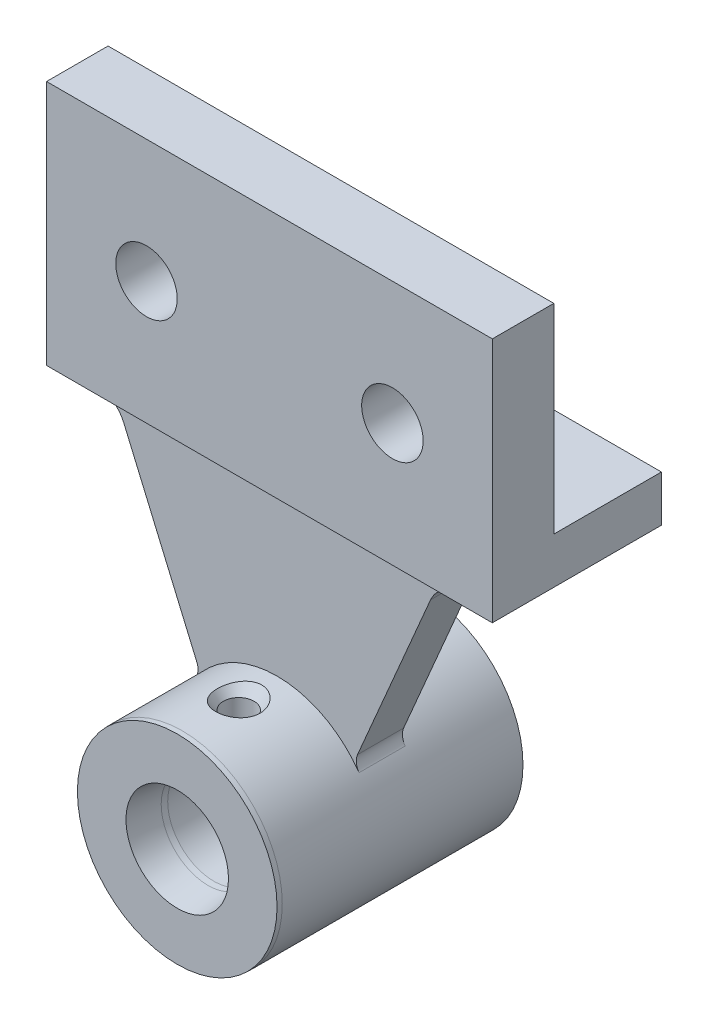
from build123d import *
from OCP.BRepFilletAPI import BRepFilletAPI_MakeChamfer

# Parameters (mm, degrees)
SKETCH_1_W               = 87
SKETCH_1_H               = 48
EXTRUDE_1_DEPTH          = 12
SKETCH_3_W               = 75
SKETCH_3_H               = 30
CUT_EXTRUDE_1_DEPTH      = 3
SKETCH_4_R               = 6
CUT_EXTRUDE_2_DEPTH      = 52.110175112
SKETCH_5_W               = 87
SKETCH_5_H               = 9
EXTRUDE_2_DEPTH          = 21
SKETCH_7_R               = 19.5
EXTRUDE_3_DEPTH          = 24
SKETCH_8_R               = 9
CUT_EXTRUDE_3_DEPTH      = 17
EXTRUDE_4_DEPTH          = 4.5
CUT_EXTRUDE_4_REACH      = 98.444
CUT_EXTRUDE_4_END_RADIUS = 9
SKETCH_13_R              = 3
CHAMFER_6_SIZE           = 1
CHAMFER_6_SIZE2          = 0.14060595
CHAMFER_6_SIZE2_2        = 0.017455065


with BuildPart() as part:
    # 草图1 → 凸台-拉伸1 (new body)
    with BuildSketch(Plane.XY):
        Rectangle(SKETCH_1_W, SKETCH_1_H)
    extrude(amount=-EXTRUDE_1_DEPTH)

    # 草图3 → 切除-拉伸1 (cut)
    with BuildSketch(Plane(origin=(0, 0, -12), x_dir=(-1, 0, 0), z_dir=(0, 0, -1))):
        Rectangle(SKETCH_3_W, SKETCH_3_H)
    extrude(amount=-CUT_EXTRUDE_1_DEPTH, mode=Mode.SUBTRACT)

    # 草图4 → 切除-拉伸2 (cut, through all)
    with BuildSketch(Plane.XY):
        with Locations((24, 0)):
            Circle(SKETCH_4_R)
        with Locations((-24, 0)):
            Circle(SKETCH_4_R)
    extrude(amount=-CUT_EXTRUDE_2_DEPTH, mode=Mode.SUBTRACT)

    # 草图5 → 凸台-拉伸2 (add)
    with BuildSketch(Plane(origin=(0, 0, -12), x_dir=(-1, 0, 0), z_dir=(0, 0, -1))):
        with Locations((0, -19.5)):
            Rectangle(SKETCH_5_W, SKETCH_5_H)
    extrude(amount=EXTRUDE_2_DEPTH)



with BuildPart() as body_2:
    # 草图7 → 凸台-拉伸3 (new, symmetric)
    with BuildSketch(Plane.XY.offset(-6)):
        with Locations((0, -75)):
            Circle(SKETCH_7_R)
    extrude(amount=EXTRUDE_3_DEPTH, both=True)

    # 草图8 → 切除-拉伸3 (cut, symmetric)
    with BuildSketch(Plane.XY.offset(-6)):
        with Locations((0, -75)):
            Circle(SKETCH_8_R)
    extrude(amount=CUT_EXTRUDE_3_DEPTH, both=True, mode=Mode.SUBTRACT)

    # 草图10 → 切除-旋转1 (revolve, cut)
    with BuildSketch(Plane(origin=(0, -75, 0), x_dir=(1, 0, 0), z_dir=(0, 1, 0))):
        Polygon((0, -18), (0, -11), (9, -11), (10, -18), align=None)
    cut_revolve_1 = revolve(axis=Axis((0, -75, 18), (0, 0, -1)), mode=Mode.SUBTRACT)

    # 镜向1: 切除-旋转1 across plane
    add(cut_revolve_1.mirror(Plane.XY.offset(-6)), mode=Mode.SUBTRACT)


with BuildPart() as part_1:
    add(part.part)

    add(body_2.part)  # 凸台-拉伸4 merges body 2
    # 草图12 → 凸台-拉伸4 (add, symmetric)
    with BuildSketch(Plane.XY.offset(-6)):
        with BuildLine():
            Line((-29.942238006, -27.63856044), (-15.687432014, -60.934386997))
            ThreePointArc((-15.687432014, -60.934386997), (-15.461093284, -62.422417649), (-15.985936875, -63.83309254))
            ThreePointArc((-15.985936875, -63.83309254), (0, -55.5), (15.985936875, -63.83309254))
            ThreePointArc((15.985936875, -63.83309254), (15.461093284, -62.422417649), (15.687432014, -60.934386997))
            Line((15.687432014, -60.934386997), (29.942238006, -27.63856044))
            ThreePointArc((29.942238006, -27.63856044), (32.154108719, -24.99157523), (35.457997537, -24))
            Line((35.457997537, -24), (-35.457997537, -24))
            ThreePointArc((-35.457997537, -24), (-32.154108719, -24.99157523), (-29.942238006, -27.63856044))
        make_face()
    extrude(amount=EXTRUDE_4_DEPTH, both=True)

    # 切除-拉伸4: up to this cylinder (the profile starts outside it)
    cut_extrude_4_end = Plane(origin=(0, -75, 6), z_dir=(0, 0, 1)) * Cylinder(CUT_EXTRUDE_4_END_RADIUS, 215.888, mode=Mode.PRIVATE)
    # 草图13 → 切除-拉伸4 (cut, up to the surface)
    with BuildSketch(Plane(origin=(0, -55.5, 0), x_dir=(1, 0, 0), z_dir=(0, 1, 0)), mode=Mode.PRIVATE) as cut_extrude_4_sk1:
        with Locations(Location((0, -6, 0), (0, 0, 270))):
            Circle(SKETCH_13_R)
    cut_extrude_4_tool1 = extrude(cut_extrude_4_sk1.sketch, amount=-CUT_EXTRUDE_4_REACH, mode=Mode.PRIVATE) - cut_extrude_4_end
    add(cut_extrude_4_tool1.solids().sort_by_distance((0, -55.5, 6))[0], mode=Mode.SUBTRACT)

    # 草图14 → 切除-旋转2 (revolve, cut)
    with BuildSketch(Plane.XY.offset(6), mode=Mode.PRIVATE) as cut_revolve_2_sk:
        Polygon((0, -55.5), (0, -57.5), (3, -57.5), (4.5, -55.5), align=None)
    revolve(cut_revolve_2_sk.sketch.rotate(Axis((0, -55.5, 6), (0, -1, 0)), 90), axis=Axis((0, -55.5, 6), (0, -1, 0)), mode=Mode.SUBTRACT)

    # 倒角6: one chamfer whose edges measure the first distance from different faces: ONE call of the kernel's chamfer builder (chamfer() names one face for all edges)
    chamfer_6_edges_1 = [part_1.edges().sort_by_distance(p)[0] for p in [
        (-9, -75, 11),
    ]]
    chamfer_6_side_1 = [part_1.faces().sort_by_distance(p)[0] for p in [
        (-9.5, -75, 14.5),
    ]]
    chamfer_6_edges_2 = [part_1.edges().sort_by_distance(p)[0] for p in [
        (-19.5, -75, -30),
    ]]
    chamfer_6_side_2 = [part_1.faces().sort_by_distance(p)[0] for p in [
        (-18.948456711, -75, -30),
    ]]
    chamfer_6_edges_3 = [part_1.edges().sort_by_distance(p)[0] for p in [
        (-19.5, -75, 18),
    ]]
    chamfer_6_side_3 = [part_1.faces().sort_by_distance(p)[0] for p in [
        (-19.5, -75, -6),
    ]]
    chamfer_6_edges_4 = [part_1.edges().sort_by_distance(p)[0] for p in [
        (-9, -75, -23),
    ]]
    chamfer_6_side_4 = [part_1.faces().sort_by_distance(p)[0] for p in [
        (-9, -75, -6),
    ]]
    chamfer_6 = BRepFilletAPI_MakeChamfer(part_1.part.solid().wrapped)
    for e in chamfer_6_edges_1:
        chamfer_6.Add(CHAMFER_6_SIZE, CHAMFER_6_SIZE2, e.wrapped, chamfer_6_side_1[0].wrapped)  # the first distance lies on this face
    for e in chamfer_6_edges_2:
        chamfer_6.Add(CHAMFER_6_SIZE, CHAMFER_6_SIZE2_2, e.wrapped, chamfer_6_side_2[0].wrapped)  # the first distance lies on this face
    for e in chamfer_6_edges_3:
        chamfer_6.Add(CHAMFER_6_SIZE, CHAMFER_6_SIZE2_2, e.wrapped, chamfer_6_side_3[0].wrapped)  # the first distance lies on this face
    for e in chamfer_6_edges_4:
        chamfer_6.Add(CHAMFER_6_SIZE, CHAMFER_6_SIZE2, e.wrapped, chamfer_6_side_4[0].wrapped)  # the first distance lies on this face
    add(Compound.cast(chamfer_6.Shape()), mode=Mode.REPLACE)


solid = part_1.part
